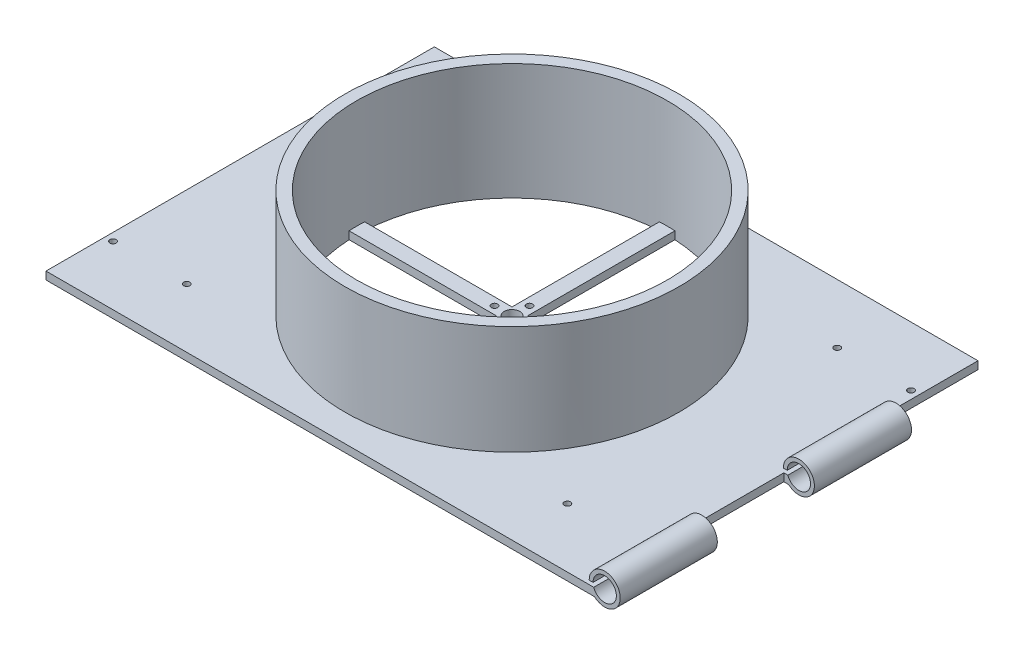
from build123d import *

# Parameters (mm, degrees)
CROQUIS1_R              = 43
CROQUIS1_R_2            = 40
SALIENTE_EXTRUIR1_DEPTH = 30
CROQUIS3_R              = 0.81
CROQUIS3_R_2            = 2
SALIENTE_EXTRUIR2_DEPTH = 2
CROQUIS4_W              = 140
CROQUIS4_H              = 100
CROQUIS4_R              = 43
SALIENTE_EXTRUIR3_DEPTH = 2
CROQUIS5_R              = 0.81
CORTAR_EXTRUIR1_DEPTH   = 2
SALIENTE_EXTRUIR7_DEPTH = 25
MATRIZL1_COUNT          = 2
MATRIZL1_PITCH          = 50


with BuildPart() as part:
    # Croquis1 → Saliente-Extruir1 (new body)
    with BuildSketch(Plane(origin=(0, 0, 0), x_dir=(1, 0, 0), z_dir=(0, 1, 0))):
        with Locations(Location((0, 0, 0), (0, 0, 270))):
            Circle(CROQUIS1_R)
        with Locations(Location((0, 0, 0), (0, 0, 270))):
            Circle(CROQUIS1_R_2, mode=Mode.SUBTRACT)
    extrude(amount=SALIENTE_EXTRUIR1_DEPTH)

    # Croquis3 → Saliente-Extruir2 (add)
    with BuildSketch(Plane(origin=(0, 0, 0), x_dir=(1, 0, 0), z_dir=(0, 1, 0))):
        with BuildLine():
            Line((-2, 39.949968711), (-2, 2))
            Line((-2, 2), (-39.949968711, 2))
            ThreePointArc((-39.949968711, 2), (-40, 0), (-39.949968711, -2))
            Line((-39.949968711, -2), (-2, -2))
            Line((-2, -2), (-2, -39.949968711))
            ThreePointArc((-2, -39.949968711), (0, -40), (2, -39.949968711))
            Line((2, -39.949968711), (2, -2))
            Line((2, -2), (39.949968711, -2))
            ThreePointArc((39.949968711, -2), (39.987490222, -1.000312842), (40, 0))
            ThreePointArc((40, 0), (39.987490222, 1.000312842), (39.949968711, 2))
            Line((39.949968711, 2), (2, 2))
            Line((2, 2), (2, 39.949968711))
            ThreePointArc((2, 39.949968711), (0, 40), (-2, 39.949968711))
        make_face()
        with Locations(Location((0, -4.5, 0), (0, 0, 270))):
            Circle(CROQUIS3_R, mode=Mode.SUBTRACT)
        with Locations(Location((-4.5, 0, 0), (0, 0, 270))):
            Circle(CROQUIS3_R, mode=Mode.SUBTRACT)
        with Locations(Location((0, 0, 0), (0, 0, 270))):
            Circle(CROQUIS3_R_2, mode=Mode.SUBTRACT)
        with Locations(Location((4.5, 0, 0), (0, 0, 270))):
            Circle(CROQUIS3_R, mode=Mode.SUBTRACT)
        with Locations(Location((0, 4.5, 0), (0, 0, 270))):
            Circle(CROQUIS3_R, mode=Mode.SUBTRACT)
    extrude(amount=SALIENTE_EXTRUIR2_DEPTH)

    # Croquis4 → Saliente-Extruir3 (add)
    with BuildSketch(Plane(origin=(0, 0, 0), x_dir=(1, 0, 0), z_dir=(0, 1, 0))):
        Rectangle(CROQUIS4_W, CROQUIS4_H)
        with Locations(Location((0, 0, 0), (0, 0, 90))):
            Circle(CROQUIS4_R, mode=Mode.SUBTRACT)
    extrude(amount=SALIENTE_EXTRUIR3_DEPTH)

    # Croquis5 → Cortar-Extruir1 (cut)
    with BuildSketch(Plane(origin=(0, 2, 0), x_dir=(1, 0, 0), z_dir=(0, 1, 0))):
        with Locations(Location((-68, -34.75, 0), (0, 0, 270))):
            Circle(CROQUIS5_R)
        with Locations(Location((-49, -34.75, 0), (0, 0, 270))):
            Circle(CROQUIS5_R)
        with Locations(Location((-49, 34.75, 0), (0, 0, 90))):
            Circle(CROQUIS5_R)
        with Locations(Location((-68, 34.75, 0), (0, 0, 90))):
            Circle(CROQUIS5_R)
        with Locations(Location((68, 34.75, 0), (0, 0, 270))):
            Circle(CROQUIS5_R)
        with Locations(Location((49, 34.75, 0), (0, 0, 270))):
            Circle(CROQUIS5_R)
        with Locations(Location((49, -34.75, 0), (0, 0, 90))):
            Circle(CROQUIS5_R)
        with Locations(Location((68, -34.75, 0), (0, 0, 90))):
            Circle(CROQUIS5_R)
    extrude(amount=-CORTAR_EXTRUIR1_DEPTH, mode=Mode.SUBTRACT)

    # Croquis7 → Saliente-Extruir7 (add)
    with BuildSketch(Plane.XY.offset(50)):
        with BuildLine():
            Line((70, 2), (70, 0))
            Line((70, 0), (71.227232035, 0))
            ThreePointArc((71.227232035, 0), (77.518734657, 4.645751311), (69.872983346, 3))
            Line((69.872983346, 3), (70.872983346, 3))
            ThreePointArc((70.872983346, 3), (76.829779025, 3.507305936), (71.044556221, 2))
            Line((71.044556221, 2), (70, 2))
        make_face()
    saliente_extruir7 = extrude(amount=-SALIENTE_EXTRUIR7_DEPTH)

    # MatrizL1: Saliente-Extruir7 ×2
    with Locations(*[(0, 0, -i * MATRIZL1_PITCH) for i in range(1, MATRIZL1_COUNT)]):
        add(saliente_extruir7)


solid = part.part
